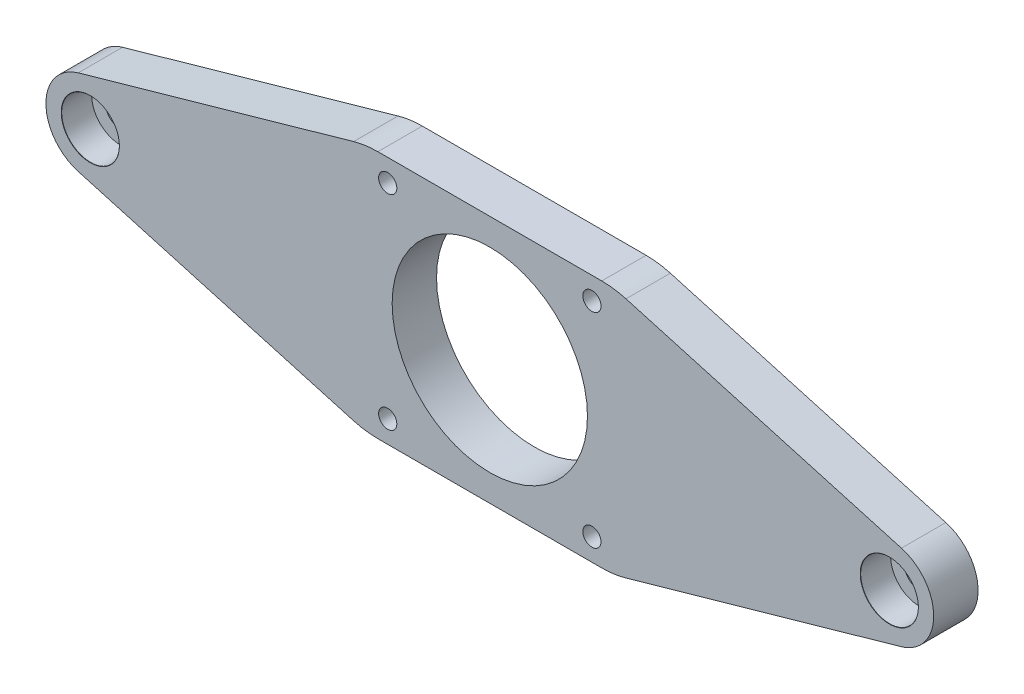
from build123d import *

# Parameters (mm, degrees)
BOSS_EXTRUDE1_DEPTH                          = 5
FILLET1_R                                    = 10
CBORE_FOR_M3_HEX_SOCKET_HEAD_CAP_SCR_2_COUNT = 2
CBORE_FOR_M3_HEX_SOCKET_HEAD_CAP_SCR_2_PITCH = 90
M2_5_TAPPED_HOLE1_D                          = 2.05
M2_5_TAPPED_HOLE1_DEPTH                      = 6.35
M2_5_TAPPED_HOLE1_TIP                        = 0.615882135


with BuildPart() as part:
    # Sketch1 → Boss-Extrude1 (new body)
    with BuildSketch(Plane.XY):
        with BuildLine():
            Line((0, 11), (0, 14))
            Line((0, 14), (-14, 14))
            Line((-14, 14), (-46.365742902, 4.809859283))
            ThreePointArc((-46.365742902, 4.809859283), (-48.989280293, 3.014239995), (-50, 0))
            Line((-50, 0), (-45, 0))
            Line((-45, 0), (-11, 0))
            ThreePointArc((-11, 0), (-7.778174593, 7.778174593), (0, 11))
        make_face()
    extrude(amount=BOSS_EXTRUDE1_DEPTH)

    # Fillet1
    fillet1_edges = [part.edges().sort_by_distance(p)[0] for p in [
        (-14, 14, 2.5),
    ]]
    fillet(fillet1_edges, radius=FILLET1_R)

    # Mirror1: part across plane


with BuildPart() as part_1:
    add(part.part)
    add(part.part.mirror(Plane(origin=(-45, 0, 5), x_dir=(0, 0, 1), z_dir=(0, -1, 0))))

    # Mirror2: part across plane


with BuildPart() as part_2:
    add(part_1.part)
    add(part_1.part.mirror(Plane(origin=(0, -11, 5), x_dir=(0, 0, 1), z_dir=(-1, 0, 0))))

    # Sketch4 → CBORE for M3 Hex Socket Head Cap Screw1 (revolve, cut)
    with BuildSketch(Plane(origin=(-45, 0, 5), x_dir=(0, -1, 0), z_dir=(1, 0, 0))):
        Polygon((0, 0), (0, 12.521463052), (1.7, 11.5), (1.7, 3.4), (3.25, 3.4), (3.25, 0.025), (3.275, 0), align=None)
    cbore_for_m3_hex_socket_head_cap_screw1 = revolve(axis=Axis((-45, 0, 11.35), (0, 0, -1)), mode=Mode.SUBTRACT)

    # CBORE for M3 Hex Socket Head Cap Scr 2: CBORE for M3 Hex Socket Head Cap Screw1 ×2
    with Locations(*[(i * CBORE_FOR_M3_HEX_SOCKET_HEAD_CAP_SCR_2_PITCH, 0, 0) for i in range(1, CBORE_FOR_M3_HEX_SOCKET_HEAD_CAP_SCR_2_COUNT)]):
        add(cbore_for_m3_hex_socket_head_cap_screw1, mode=Mode.SUBTRACT)

    # M2.5 Tapped Hole1
    with Locations(Plane.XY.offset(5)):
        with Locations((-11.5, 11.5), (11.5, 11.5), (11.5, -11.5), (-11.5, -11.5)):
            Hole(M2_5_TAPPED_HOLE1_D / 2, depth=M2_5_TAPPED_HOLE1_DEPTH)
            with Locations((0, 0, -(M2_5_TAPPED_HOLE1_DEPTH + M2_5_TAPPED_HOLE1_TIP / 2))):  # 118° drill point
                Cone(0, M2_5_TAPPED_HOLE1_D / 2, M2_5_TAPPED_HOLE1_TIP, mode=Mode.SUBTRACT)


solid = part_2.part
